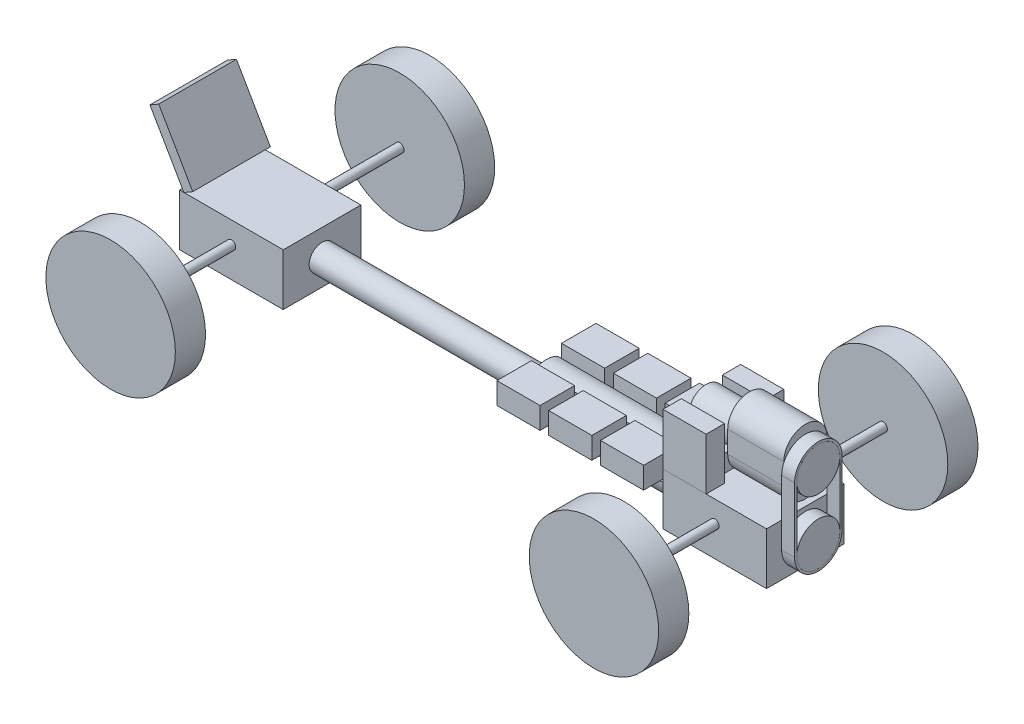
from build123d import *

# Parameters (mm, degrees)
SKETCH4_R              = 381
BOSS_EXTRUDE1_DEPTH    = 88.9
BOSS_EXTRUDE1_2_DEPTH  = 88.9
SKETCH3_R              = 381
BOSS_EXTRUDE2_DEPTH    = 88.9
BOSS_EXTRUDE2_2_DEPTH  = 88.9
BOSS_EXTRUDE3_START    = 203.2
SKETCH1_W              = 609.6
SKETCH1_H              = 457.2
BOSS_EXTRUDE3_DEPTH    = 304.8
BOSS_EXTRUDE3_2_DEPTH  = 304.8
SKETCH5_R              = 76.2
BOSS_EXTRUDE4_DEPTH    = 914.4
SKETCH5_3_R            = 76.2
BOSS_EXTRUDE5_DEPTH    = 2235.2
SKETCH6_R              = 127
BOSS_EXTRUDE6_DEPTH    = 76.2
BOSS_EXTRUDE6_2_DEPTH  = 76.2
BOSS_EXTRUDE8_DEPTH    = 330.2
SKETCH9_R              = 101.6
BOSS_EXTRUDE9_DEPTH    = 254
BOSS_EXTRUDE10_DEPTH   = 76.2
SKETCH11_W             = 254
SKETCH11_H             = 203.2
BOSS_EXTRUDE11_DEPTH   = 127
BOSS_EXTRUDE11_2_DEPTH = 127
BOSS_EXTRUDE11_3_DEPTH = 127
BOSS_EXTRUDE11_4_DEPTH = 127
BOSS_EXTRUDE11_5_DEPTH = 127
BOSS_EXTRUDE11_6_DEPTH = 127
BOSS_EXTRUDE12_DEPTH   = 304.8
BOSS_EXTRUDE12_2_DEPTH = 304.8
SKETCH12_3_W           = 177.8
SKETCH12_3_H           = 120.65
BOSS_EXTRUDE13_DEPTH   = 101.6
BOSS_EXTRUDE15_REACH   = 2649.242
SKETCH13_R             = 25.4
BOSS_EXTRUDE16_DEPTH   = 457.2


with BuildPart() as part:
    # Sketch4 → Boss-Extrude1 (new, symmetric)
    with BuildSketch(Plane.XY.offset(-850.9)):
        with Locations((1422.4, 381)):
            Circle(SKETCH4_R)
    extrude(amount=BOSS_EXTRUDE1_DEPTH, both=True)


with BuildPart() as body_2:
    # Sketch4 → Boss-Extrude1 2 (new, symmetric)
    with BuildSketch(Plane.XY.offset(-850.9)):
        with Locations((-1422.4, 381)):
            Circle(SKETCH4_R)
    extrude(amount=BOSS_EXTRUDE1_2_DEPTH, both=True)


with BuildPart() as body_3:
    # Sketch3 → Boss-Extrude2 (new, symmetric)
    with BuildSketch(Plane.XY.offset(850.9)):
        with Locations((1422.4, 381)):
            Circle(SKETCH3_R)
    extrude(amount=BOSS_EXTRUDE2_DEPTH, both=True)


with BuildPart() as body_4:
    # Sketch3 → Boss-Extrude2 2 (new, symmetric)
    with BuildSketch(Plane.XY.offset(850.9)):
        with Locations((-1422.4, 381)):
            Circle(SKETCH3_R)
    extrude(amount=BOSS_EXTRUDE2_2_DEPTH, both=True)

    # Boss-Extrude15: up to this face of the body (flat: up to its plane)
    boss_extrude15_end = Plane(body_4.part.faces().sort_by_distance((-1422.4, 381, 762))[0])
    # Sketch13 → Boss-Extrude15 (add, up to the picked face)
    with BuildSketch(Plane.XY.offset(-762), mode=Mode.PRIVATE) as boss_extrude15_sk1:
        with Locations(Location((-1422.4, 381, 0), (0, 0, 180))):
            Circle(SKETCH13_R)
    boss_extrude15_tool1 = split(extrude(boss_extrude15_sk1.sketch, amount=BOSS_EXTRUDE15_REACH, mode=Mode.PRIVATE), bisect_by=boss_extrude15_end, keep=Keep.BOTH, mode=Mode.PRIVATE)
    # Sketch13 → Boss-Extrude15 (add, up to the picked face)
    with BuildSketch(Plane.XY.offset(-762), mode=Mode.PRIVATE) as boss_extrude15_sk2:
        with Locations(Location((1422.4, 381, 0), (0, 0, 180))):
            Circle(SKETCH13_R)
    boss_extrude15_tool2 = split(extrude(boss_extrude15_sk2.sketch, amount=BOSS_EXTRUDE15_REACH, mode=Mode.PRIVATE), bisect_by=boss_extrude15_end, keep=Keep.BOTH, mode=Mode.PRIVATE)

    add(part.part)  # Boss-Extrude15 merges part

    add(body_2.part)  # Boss-Extrude15 merges body 2

    add(body_3.part)  # Boss-Extrude15 merges body 3


with BuildPart() as body_5:
    # Sketch1 → Boss-Extrude3 (new body)
    with BuildSketch(Plane(origin=(0, 0, 0), x_dir=(1, 0, 0), z_dir=(0, 1, 0)).offset(BOSS_EXTRUDE3_START)):
        with Locations((1422.4, 0)):
            Rectangle(SKETCH1_W, SKETCH1_H)
    extrude(amount=BOSS_EXTRUDE3_DEPTH)


with BuildPart() as body_6:
    # Sketch1 → Boss-Extrude3 2 (new body)
    with BuildSketch(Plane(origin=(0, 0, 0), x_dir=(1, 0, 0), z_dir=(0, 1, 0)).offset(BOSS_EXTRUDE3_START)):
        with Locations((-1422.4, 0)):
            Rectangle(SKETCH1_W, SKETCH1_H)
    extrude(amount=BOSS_EXTRUDE3_2_DEPTH)


with BuildPart() as body_7:
    # Sketch5 → Boss-Extrude4 (new body)
    with BuildSketch(Plane.ZY.offset(-1117.6)):
        with BuildLine():
            Line((-65.991135768, 478.731068378), (-65.991135768, 393.7))
            ThreePointArc((-65.991135768, 393.7), (0, 431.8), (65.991135768, 393.7))
            Line((65.991135768, 393.7), (65.991135768, 478.731068378))
            ThreePointArc((65.991135768, 478.731068378), (0, 495.3), (-65.991135768, 478.731068378))
        make_face()
        with BuildLine():
            Line((139.630201095, 351.184465811), (65.991135768, 393.7))
            ThreePointArc((65.991135768, 393.7), (73.603547963, 375.322011237), (76.2, 355.6))
            ThreePointArc((76.2, 355.6), (53.881536726, 301.718463274), (0, 279.4))
            Line((0, 279.4), (73.639065327, 236.884465811))
            ThreePointArc((73.639065327, 236.884465811), (120.983748909, 285.75), (139.630201095, 351.184465811))
        make_face()
        with BuildLine():
            ThreePointArc((0, 279.4), (-65.991135768, 317.5), (-65.991135768, 393.7))
            Line((-65.991135768, 393.7), (-139.630201095, 351.184465811))
            ThreePointArc((-139.630201095, 351.184465811), (-120.983748909, 285.75), (-73.639065327, 236.884465811))
            Line((-73.639065327, 236.884465811), (0, 279.4))
        make_face()
        with Locations((0, 355.6)):
            Circle(SKETCH5_R)
    extrude(amount=BOSS_EXTRUDE4_DEPTH)


with BuildPart() as body_8:
    # Sketch5<3> → Boss-Extrude5 (new body)
    with BuildSketch(Plane.ZY.offset(-1117.6)):
        with Locations((0, 355.6)):
            Circle(SKETCH5_3_R)
    extrude(amount=BOSS_EXTRUDE5_DEPTH)


with BuildPart() as body_9:
    # Sketch6 → Boss-Extrude6 (new body)
    with BuildSketch(Plane(origin=(1727.2, 0, 0), x_dir=(0, 0, -1), z_dir=(1, 0, 0))):
        with Locations(Location((0, 355.6, 0), (0, 0, 180))):
            Circle(SKETCH6_R)
    extrude(amount=BOSS_EXTRUDE6_DEPTH)


with BuildPart() as body_10:
    # Sketch6 → Boss-Extrude6 2 (new body)
    with BuildSketch(Plane(origin=(1727.2, 0, 0), x_dir=(0, 0, -1), z_dir=(1, 0, 0))):
        with Locations(Location((0, 736.6, 0), (0, 0, 180))):
            Circle(SKETCH6_R)
    extrude(amount=BOSS_EXTRUDE6_2_DEPTH)


with BuildPart() as body_11:
    # Sketch8 → Boss-Extrude8 (new body)
    with BuildSketch(Plane.ZY.offset(-1727.2)):
        with BuildLine():
            Line((-127, 673.1), (-127, 800.1))
            ThreePointArc((-127, 800.1), (0, 927.1), (127, 800.1))
            Line((127, 800.1), (127, 673.1))
            ThreePointArc((127, 673.1), (0, 546.1), (-127, 673.1))
        make_face()
    extrude(amount=BOSS_EXTRUDE8_DEPTH)


with BuildPart() as body_12:
    # Sketch9 → Boss-Extrude9 (new body)
    with BuildSketch(Plane.ZY.offset(-1397)):
        with Locations((0, 736.6)):
            Circle(SKETCH9_R)
    extrude(amount=BOSS_EXTRUDE9_DEPTH)


with BuildPart() as body_13:
    # Sketch6<3> → Boss-Extrude10 (new body)
    with BuildSketch(Plane(origin=(1727.2, 0, 0), x_dir=(0, 0, -1), z_dir=(1, 0, 0))):
        with BuildLine():
            Line((139.7, 736.6), (139.7, 355.6))
            ThreePointArc((139.7, 355.6), (0, 215.9), (-139.7, 355.6))
            Line((-139.7, 355.6), (-139.7, 736.6))
            ThreePointArc((-139.7, 736.6), (0, 876.3), (139.7, 736.6))
        make_face()
        with BuildLine():
            Line((-127, 355.6), (-127, 736.6))
            ThreePointArc((-127, 736.6), (0, 863.6), (127, 736.6))
            Line((127, 736.6), (127, 355.6))
            ThreePointArc((127, 355.6), (0, 228.6), (-127, 355.6))
        make_face(mode=Mode.SUBTRACT)
    extrude(amount=BOSS_EXTRUDE10_DEPTH)


with BuildPart() as body_14:
    # Sketch11 → Boss-Extrude11 (new body)
    with BuildSketch(Plane(origin=(0, 406.4, 0), x_dir=(1, 0, 0), z_dir=(0, 1, 0))):
        with Locations((635, -190.260072631)):
            Rectangle(SKETCH11_W, SKETCH11_H)
    extrude(amount=BOSS_EXTRUDE11_DEPTH)


with BuildPart() as body_15:
    # Sketch11 → Boss-Extrude11 2 (new body)
    with BuildSketch(Plane(origin=(0, 406.4, 0), x_dir=(1, 0, 0), z_dir=(0, 1, 0))):
        with Locations((330.2, -190.260072631)):
            Rectangle(SKETCH11_W, SKETCH11_H)
    extrude(amount=BOSS_EXTRUDE11_2_DEPTH)


with BuildPart() as body_16:
    # Sketch11 → Boss-Extrude11 3 (new body)
    with BuildSketch(Plane(origin=(0, 406.4, 0), x_dir=(1, 0, 0), z_dir=(0, 1, 0))):
        with Locations((939.8, -190.260072631)):
            Rectangle(SKETCH11_W, SKETCH11_H)
    extrude(amount=BOSS_EXTRUDE11_3_DEPTH)


with BuildPart() as body_17:
    # Sketch11 → Boss-Extrude11 4 (new body)
    with BuildSketch(Plane(origin=(0, 406.4, 0), x_dir=(1, 0, 0), z_dir=(0, 1, 0))):
        with Locations((939.8, 190.260072631)):
            Rectangle(SKETCH11_W, SKETCH11_H)
    extrude(amount=BOSS_EXTRUDE11_4_DEPTH)


with BuildPart() as body_18:
    # Sketch11 → Boss-Extrude11 5 (new body)
    with BuildSketch(Plane(origin=(0, 406.4, 0), x_dir=(1, 0, 0), z_dir=(0, 1, 0))):
        with Locations((635, 190.260072631)):
            Rectangle(SKETCH11_W, SKETCH11_H)
    extrude(amount=BOSS_EXTRUDE11_5_DEPTH)


with BuildPart() as body_19:
    # Sketch11 → Boss-Extrude11 6 (new body)
    with BuildSketch(Plane(origin=(0, 406.4, 0), x_dir=(1, 0, 0), z_dir=(0, 1, 0))):
        with Locations((330.2, 190.260072631)):
            Rectangle(SKETCH11_W, SKETCH11_H)
    extrude(amount=BOSS_EXTRUDE11_6_DEPTH)


with BuildPart() as body_20:
    # Sketch12 → Boss-Extrude12 (new body)
    with BuildSketch(Plane(origin=(0, 508, 0), x_dir=(1, 0, 0), z_dir=(0, 1, 0))):
        Polygon((1371.6, 228.6), (1117.6, 228.6), (1117.6, 120.65), (1143, 120.65), (1320.8, 120.65), (1371.6, 120.65), align=None)
    extrude(amount=BOSS_EXTRUDE12_DEPTH)



with BuildPart() as body_21:
    # Sketch12 → Boss-Extrude12 2 (new body)
    with BuildSketch(Plane(origin=(0, 508, 0), x_dir=(1, 0, 0), z_dir=(0, 1, 0))):
        Polygon((1143, -120.65), (1117.6, -120.65), (1117.6, -228.6), (1371.6, -228.6), (1371.6, -120.65), (1320.8, -120.65), align=None)
    extrude(amount=BOSS_EXTRUDE12_2_DEPTH)


with BuildPart() as body_20_1:
    add(body_20.part)

    add(body_21.part)  # Boss-Extrude13 merges body 21
    # Sketch12<3> → Boss-Extrude13 (add)
    with BuildSketch(Plane(origin=(0, 508, 0), x_dir=(1, 0, 0), z_dir=(0, 1, 0))):
        with Locations((1231.9, -60.325)):
            Rectangle(SKETCH12_3_W, SKETCH12_3_H)
        with Locations((1231.9, 60.325)):
            Rectangle(SKETCH12_3_W, SKETCH12_3_H)
    extrude(amount=BOSS_EXTRUDE13_DEPTH)


with BuildPart() as body_4_1:
    add(body_4.part)

    add(body_5.part)  # Boss-Extrude15 merges body 5

    add(body_6.part)  # Boss-Extrude15 merges body 6
    add(boss_extrude15_tool1.solids().sort_by(Axis((-1422.4, 381, -762), (0, 0, 1)))[0])
    add(boss_extrude15_tool2.solids().sort_by(Axis((1422.4, 381, -762), (0, 0, 1)))[0])


with BuildPart() as body_16_2:
    # Sketch15 → Boss-Extrude16 (new body)
    with BuildSketch(Plane.XY.offset(228.6)):
        Polygon((-1902.2, 854.410161514), (-1702.2, 508), (-1650.238475773, 538), (-1850.238475773, 884.410161514), align=None)
    extrude(amount=-BOSS_EXTRUDE16_DEPTH)


solid = Compound([body_7.part, body_8.part, body_9.part, body_10.part, body_11.part, body_12.part, body_13.part, body_14.part, body_15.part, body_16.part, body_17.part, body_18.part, body_19.part, body_20_1.part, body_4_1.part, body_16_2.part])
